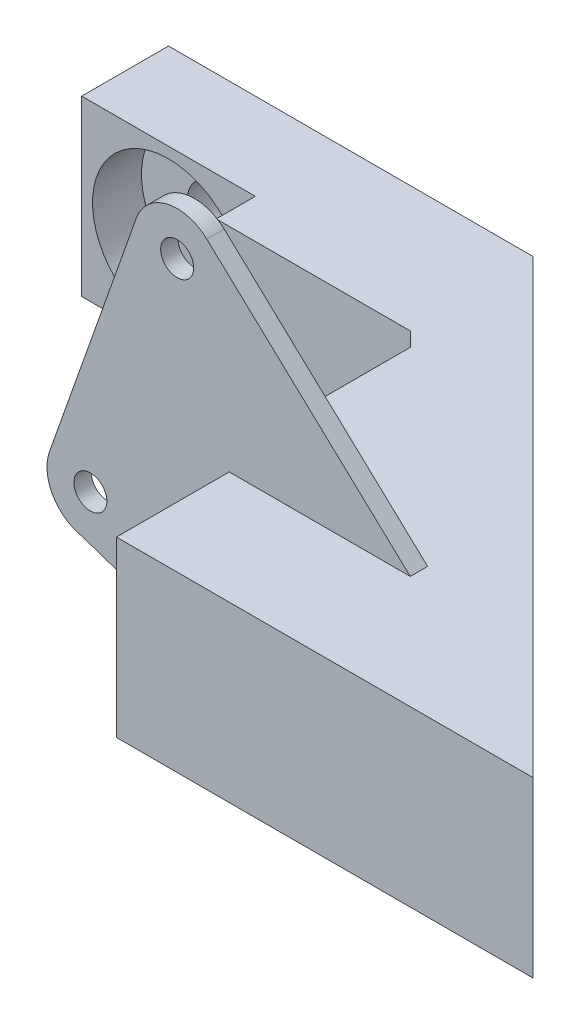
from build123d import *

# Parameters (mm, degrees)
BOSS_EXTRUDE1_DEPTH = 25.4
SKETCH2_R           = 11.1125
CUT_EXTRUDE1_DEPTH  = 7.1628
CUT_EXTRUDE2_REACH  = 123.946
SKETCH2_3_R         = 4.445
BOSS_EXTRUDE2_DEPTH = 68.58
CUT_EXTRUDE3_REACH  = 138.151
SKETCH4_R           = 2.413
CUT_EXTRUDE4_REACH  = 138.151
CUT_EXTRUDE5_START  = 16.51
CUT_EXTRUDE5_DEPTH  = 16.51
CUT_EXTRUDE7_REACH  = 131.829
CUT_EXTRUDE8_REACH  = 155.739
CUT_EXTRUDE10_REACH = 131.829
BOSS_EXTRUDE3_DEPTH = 2.54


with BuildPart() as part:
    # Sketch1 → Boss-Extrude1 (new body)
    with BuildSketch(Plane(origin=(0, 0, 0), x_dir=(1, 0, 0), z_dir=(0, 1, 0))):
        Polygon((35.379487758, -53.34), (22.679487758, -40.64), (-12.7, -40.64), (-12.7, -53.34), (12.7, -53.34), align=None)
        Polygon((90.17, -90.17), (40.64, -40.64), (22.679487758, -40.64), (35.379487758, -53.34), (41.094487758, -59.055), (43.18, -61.140512242), (72.209487758, -90.17), align=None)
        Polygon((41.094487758, -59.055), (35.379487758, -53.34), (12.7, -53.34), (12.7, -59.055), align=None)
        Polygon((45.72, -90.17), (72.209487758, -90.17), (43.18, -61.140512242), (43.18, -87.63), (16.51, -87.63), (16.51, -90.17), align=None)
        Polygon((88.719487758, -106.68), (72.209487758, -90.17), (45.72, -90.17), (45.72, -106.68), align=None)
        Polygon((106.68, -106.68), (90.17, -90.17), (72.209487758, -90.17), (88.719487758, -106.68), align=None)
    extrude(amount=BOSS_EXTRUDE1_DEPTH)

    # Sketch2 → Cut-Extrude1 (cut)
    with BuildSketch(Plane.XY.offset(53.34)):
        with Locations((0, 12.7)):
            Circle(SKETCH2_R)
    extrude(amount=-CUT_EXTRUDE1_DEPTH, mode=Mode.SUBTRACT)

    # Sketch2<3> → Cut-Extrude2 (cut, up to next)
    with BuildSketch(Plane.XY.offset(53.34), mode=Mode.PRIVATE) as cut_extrude2_sk1:
        with Locations((0, 12.7)):
            Circle(SKETCH2_3_R)
    cut_extrude2_tool1 = extrude(cut_extrude2_sk1.sketch, amount=-CUT_EXTRUDE2_REACH, mode=Mode.PRIVATE) & part.part
    add(cut_extrude2_tool1.solids().sort_by_distance((0, 12.7, 53.34))[0], mode=Mode.SUBTRACT)

    # Sketch1<3> → Boss-Extrude2 (add)
    with BuildSketch(Plane(origin=(0, 0, 0), x_dir=(1, 0, 0), z_dir=(0, 1, 0))):
        Polygon((88.719487758, -106.68), (72.209487758, -90.17), (45.72, -90.17), (45.72, -106.68), align=None)
        Polygon((45.72, -90.17), (72.209487758, -90.17), (43.18, -61.140512242), (43.18, -87.63), (16.51, -87.63), (16.51, -90.17), align=None)
    extrude(amount=BOSS_EXTRUDE2_DEPTH)

    # Sketch4 → Cut-Extrude3 (cut, up to next)
    with BuildSketch(Plane.XY.offset(90.17), mode=Mode.PRIVATE) as cut_extrude3_sk1:
        with Locations((38.1, 48.621024484)):
            Circle(SKETCH4_R)
    cut_extrude3_tool1 = extrude(cut_extrude3_sk1.sketch, amount=-CUT_EXTRUDE3_REACH, mode=Mode.PRIVATE) & part.part
    # Sketch4 → Cut-Extrude3 (cut, up to next)
    with BuildSketch(Plane.XY.offset(90.17), mode=Mode.PRIVATE) as cut_extrude3_sk2:
        with Locations((25.4, 12.7)):
            Circle(SKETCH4_R)
    cut_extrude3_tool2 = extrude(cut_extrude3_sk2.sketch, amount=-CUT_EXTRUDE3_REACH, mode=Mode.PRIVATE) & part.part
    add(cut_extrude3_tool1.solids().sort_by_distance((38.1, 48.621024, 90.17))[0], mode=Mode.SUBTRACT)
    add(cut_extrude3_tool2.solids().sort_by_distance((25.4, 12.7, 90.17))[0], mode=Mode.SUBTRACT)

    # Sketch4<4> → Cut-Extrude4 (cut, up to next)
    with BuildSketch(Plane.XY.offset(90.17), mode=Mode.PRIVATE) as cut_extrude4_sk1:
        with BuildLine():
            ThreePointArc((16.51, 50.529162362), (23.165769401, 46.860982905), (29.036193408, 42.034708067))
            Line((29.036193408, 42.034708067), (32.113162586, 50.737691151))
            ThreePointArc((32.113162586, 50.737691151), (35.962630111, 54.600501883), (41.388506693, 54.053171733))
            Line((41.388506693, 54.053171733), (88.719487758, 25.4))
            Line((88.719487758, 25.4), (88.719487758, 68.58))
            Line((88.719487758, 68.58), (16.51, 68.58))
            Line((16.51, 68.58), (16.51, 50.529162362))
        make_face()
    cut_extrude4_tool1 = extrude(cut_extrude4_sk1.sketch, amount=-CUT_EXTRUDE4_REACH, mode=Mode.PRIVATE) & part.part
    # Sketch4<4> → Cut-Extrude4 (cut, up to next)
    with BuildSketch(Plane.XY.offset(90.17), mode=Mode.PRIVATE) as cut_extrude4_sk2:
        with BuildLine():
            ThreePointArc((24.141722061, 6.475914796), (23.355096734, 6.688272242), (22.602138971, 6.999607587))
            ThreePointArc((22.602138971, 6.999607587), (19.520430726, 10.301424349), (19.413162586, 14.816666667))
            Line((19.413162586, 14.816666667), (29.036193408, 42.034708067))
            ThreePointArc((29.036193408, 42.034708067), (23.165769401, 46.860982905), (16.51, 50.529162362))
            Line((16.51, 50.529162362), (16.51, 0))
            Line((16.51, 0), (39.272581084, 0))
            ThreePointArc((39.272581084, 0), (39.461690116, 0.600386859), (39.64162121, 1.203587826))
            Line((39.64162121, 1.203587826), (24.141722061, 6.475914796))
        make_face()
    cut_extrude4_tool2 = extrude(cut_extrude4_sk2.sketch, amount=-CUT_EXTRUDE4_REACH, mode=Mode.PRIVATE) & part.part
    add(cut_extrude4_tool1.solids().sort_by_distance((58.41037, 54.420035, 90.17))[0], mode=Mode.SUBTRACT)
    add(cut_extrude4_tool2.solids().sort_by_distance((21.980861, 24.151697, 90.17))[0], mode=Mode.SUBTRACT)

    # Sketch4<7> → Cut-Extrude5 (cut)
    with BuildSketch(Plane.XY.offset(90.17).offset(CUT_EXTRUDE5_START)):
        with BuildLine():
            ThreePointArc((16.51, 50.529162362), (23.165769401, 46.860982905), (29.036193408, 42.034708067))
            Line((29.036193408, 42.034708067), (32.113162586, 50.737691151))
            ThreePointArc((32.113162586, 50.737691151), (35.962630111, 54.600501883), (41.388506693, 54.053171733))
            Line((41.388506693, 54.053171733), (88.719487758, 25.4))
            Line((88.719487758, 25.4), (88.719487758, 68.58))
            Line((88.719487758, 68.58), (16.51, 68.58))
            Line((16.51, 68.58), (16.51, 50.529162362))
        make_face()
        with BuildLine():
            ThreePointArc((24.141722061, 6.475914796), (23.355096734, 6.688272242), (22.602138971, 6.999607587))
            ThreePointArc((22.602138971, 6.999607587), (19.520430726, 10.301424349), (19.413162586, 14.816666667))
            Line((19.413162586, 14.816666667), (29.036193408, 42.034708067))
            ThreePointArc((29.036193408, 42.034708067), (23.165769401, 46.860982905), (16.51, 50.529162362))
            Line((16.51, 50.529162362), (16.51, 0))
            Line((16.51, 0), (39.272581084, 0))
            ThreePointArc((39.272581084, 0), (39.461690116, 0.600386859), (39.64162121, 1.203587826))
            Line((39.64162121, 1.203587826), (24.141722061, 6.475914796))
        make_face()
        with BuildLine():
            Line((43.18, 0), (39.64162121, 1.203587826))
            ThreePointArc((39.64162121, 1.203587826), (39.461690116, 0.600386859), (39.272581084, 0))
            Line((39.272581084, 0), (43.18, 0))
        make_face()
    extrude(amount=-CUT_EXTRUDE5_DEPTH, mode=Mode.SUBTRACT)

    # Sketch4<10> → Cut-Extrude7 (cut, up to next)
    with BuildSketch(Plane.XY.offset(90.17), mode=Mode.PRIVATE) as cut_extrude7_sk1:
        with BuildLine():
            Line((43.18, 0), (39.64162121, 1.203587826))
            ThreePointArc((39.64162121, 1.203587826), (39.461690116, 0.600386859), (39.272581084, 0))
            Line((39.272581084, 0), (43.18, 0))
        make_face()
    cut_extrude7_tool1 = extrude(cut_extrude7_sk1.sketch, amount=-CUT_EXTRUDE7_REACH, mode=Mode.PRIVATE) & part.part
    add(cut_extrude7_tool1.solids().sort_by_distance((40.700194, 0.400853, 90.17))[0], mode=Mode.SUBTRACT)

    # Sketch7 → Cut-Extrude8 (cut, up to next)
    with BuildSketch(Plane(origin=(0, 25.4, 0), x_dir=(1, 0, 0), z_dir=(0, 1, 0)), mode=Mode.PRIVATE) as cut_extrude8_sk1:
        Polygon((43.18, -61.140512242), (43.18, -87.63), (69.669487758, -87.63), align=None)
    cut_extrude8_tool1 = extrude(cut_extrude8_sk1.sketch, amount=CUT_EXTRUDE8_REACH, mode=Mode.PRIVATE) & part.part
    # Sketch7 → Cut-Extrude8 (cut, up to next)
    with BuildSketch(Plane(origin=(0, 25.4, 0), x_dir=(1, 0, 0), z_dir=(0, 1, 0)), mode=Mode.PRIVATE) as cut_extrude8_sk2:
        Polygon((45.72, -90.17), (72.209487758, -90.17), (88.719487758, -106.68), (45.72, -106.68), align=None)
    cut_extrude8_tool2 = extrude(cut_extrude8_sk2.sketch, amount=CUT_EXTRUDE8_REACH, mode=Mode.PRIVATE) & part.part
    add(cut_extrude8_tool1.solids().sort_by_distance((52.009829, 25.4, 78.800171))[0], mode=Mode.SUBTRACT)
    add(cut_extrude8_tool2.solids().sort_by_distance((63.41913, 25.4, 99.078773))[0], mode=Mode.SUBTRACT)

    # Sketch8 → Cut-Extrude10 (cut, up to next)
    with BuildSketch(Plane.XY.offset(90.17), mode=Mode.PRIVATE) as cut_extrude10_sk1:
        with BuildLine():
            Line((69.540863311, 27.897131539), (72.209487758, 25.4))
            Line((72.209487758, 25.4), (72.209487758, 35.394803713))
            Line((72.209487758, 35.394803713), (41.388506693, 54.053171733))
            ThreePointArc((41.388506693, 54.053171733), (41.934277279, 53.682725557), (42.438674479, 53.257661602))
            Line((42.438674479, 53.257661602), (69.540863311, 27.897131539))
        make_face()
    cut_extrude10_tool1 = extrude(cut_extrude10_sk1.sketch, amount=-CUT_EXTRUDE10_REACH, mode=Mode.PRIVATE) & part.part
    add(cut_extrude10_tool1.solids().sort_by_distance((62.122661, 38.169884, 90.17))[0], mode=Mode.SUBTRACT)

    # Sketch8<3> → Boss-Extrude3 (add)
    with BuildSketch(Plane.XY.offset(90.17)):
        Polygon((69.540863311, 25.4), (72.209487758, 25.4), (69.540863311, 27.897131539), align=None)
    extrude(amount=-BOSS_EXTRUDE3_DEPTH)


solid = part.part
